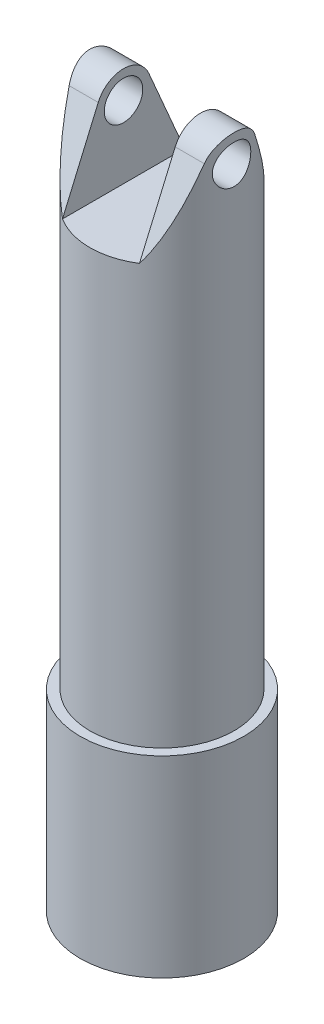
from build123d import *

# Parameters (mm, degrees)
SKETCH_1_R          = 17
EXTRUDE_1_DEPTH     = 40
SKETCH_2_R          = 15
EXTRUDE_2_DEPTH     = 110
SKETCH_3_W          = 16
SKETCH_3_H          = 46
CUT_EXTRUDE_1_DEPTH = 15
SKETCH_4_R          = 4
CUT_EXTRUDE_2_DEPTH = 15
CUT_EXTRUDE_4_DEPTH = 15


with BuildPart() as part:
    # 草图1 → 凸台-拉伸1 (new body)
    with BuildSketch(Plane(origin=(0, 0, 0), x_dir=(1, 0, 0), z_dir=(0, 1, 0))):
        with Locations(Location((0, 0, 0), (0, 0, 270))):
            Circle(SKETCH_1_R)
    extrude(amount=EXTRUDE_1_DEPTH)

    # 草图2 → 凸台-拉伸2 (add)
    with BuildSketch(Plane(origin=(0, 40, 0), x_dir=(1, 0, 0), z_dir=(0, 1, 0))):
        with Locations(Location((0, 0, 0), (0, 0, 270))):
            Circle(SKETCH_2_R)
    extrude(amount=EXTRUDE_2_DEPTH)

    # 草图3 → 切除-拉伸1 (cut, symmetric)
    with BuildSketch(Plane.XY):
        with Locations((0, 150)):
            Rectangle(SKETCH_3_W, SKETCH_3_H)
    extrude(amount=CUT_EXTRUDE_1_DEPTH, both=True, mode=Mode.SUBTRACT)

    # 草图4 → 切除-拉伸2 (cut, symmetric)
    with BuildSketch(Plane(origin=(0, 0, 0), x_dir=(0, 0, -1), z_dir=(1, 0, 0))):
        with Locations(Location((0, 142, 0), (0, 0, 270))):
            Circle(SKETCH_4_R)
    extrude(amount=CUT_EXTRUDE_2_DEPTH, both=True, mode=Mode.SUBTRACT)

    # 草图8 → 切除-拉伸4 (cut, symmetric)
    with BuildSketch(Plane(origin=(0, 0, 0), x_dir=(0, 0, -1), z_dir=(1, 0, 0))):
        with BuildLine():
            Line((-12.68857754, 127), (-5.256345918, 144.263010824))
            ThreePointArc((-5.256345918, 144.263010824), (0, 147.722795681), (5.256345918, 144.263010824))
            Line((5.256345918, 144.263010824), (12.68857754, 127))
            Line((12.68857754, 127), (12.68857754, 150))
            Line((12.68857754, 150), (-12.68857754, 150))
            Line((-12.68857754, 150), (-12.68857754, 127))
        make_face()
    extrude(amount=CUT_EXTRUDE_4_DEPTH, both=True, mode=Mode.SUBTRACT)


solid = part.part
